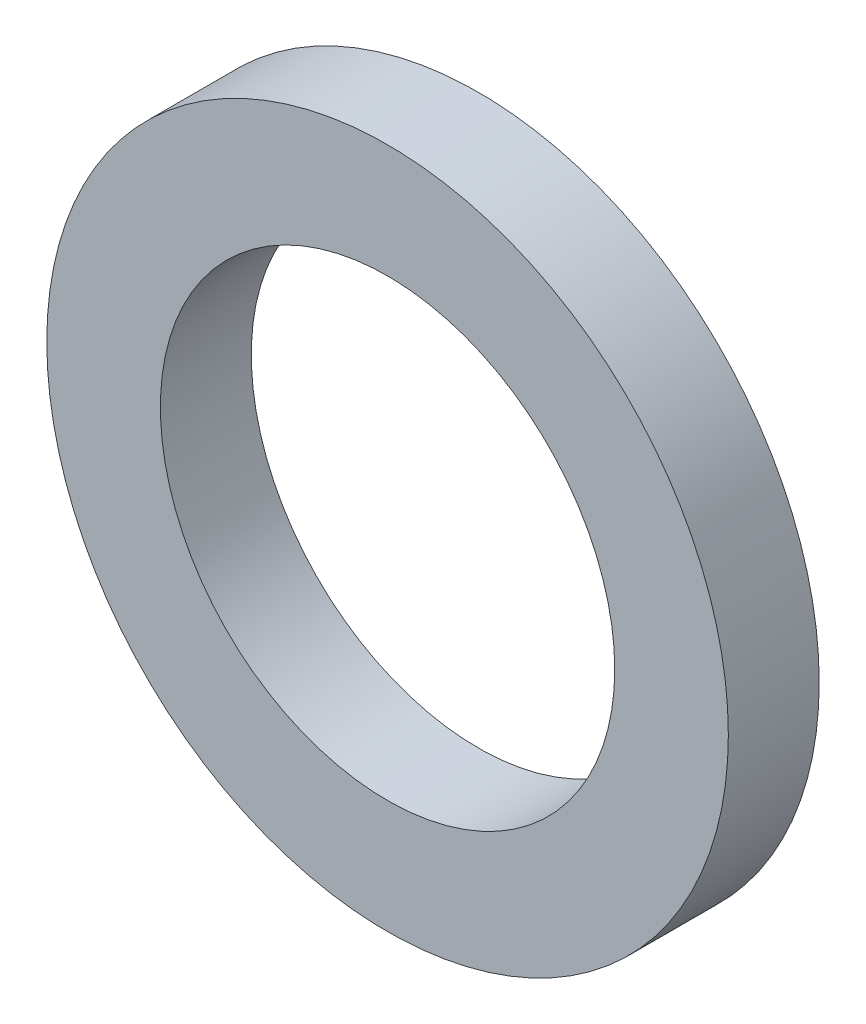
from build123d import *

# Parameters (mm, degrees)
SKETCH1_R           = 15
SKETCH1_R_2         = 10
BOSS_EXTRUDE1_DEPTH = 4


with BuildPart() as part:
    # Sketch1 → Boss-Extrude1 (new body)
    with BuildSketch(Plane.XY):
        Circle(SKETCH1_R)
        Circle(SKETCH1_R_2, mode=Mode.SUBTRACT)
    extrude(amount=BOSS_EXTRUDE1_DEPTH)


solid = part.part
